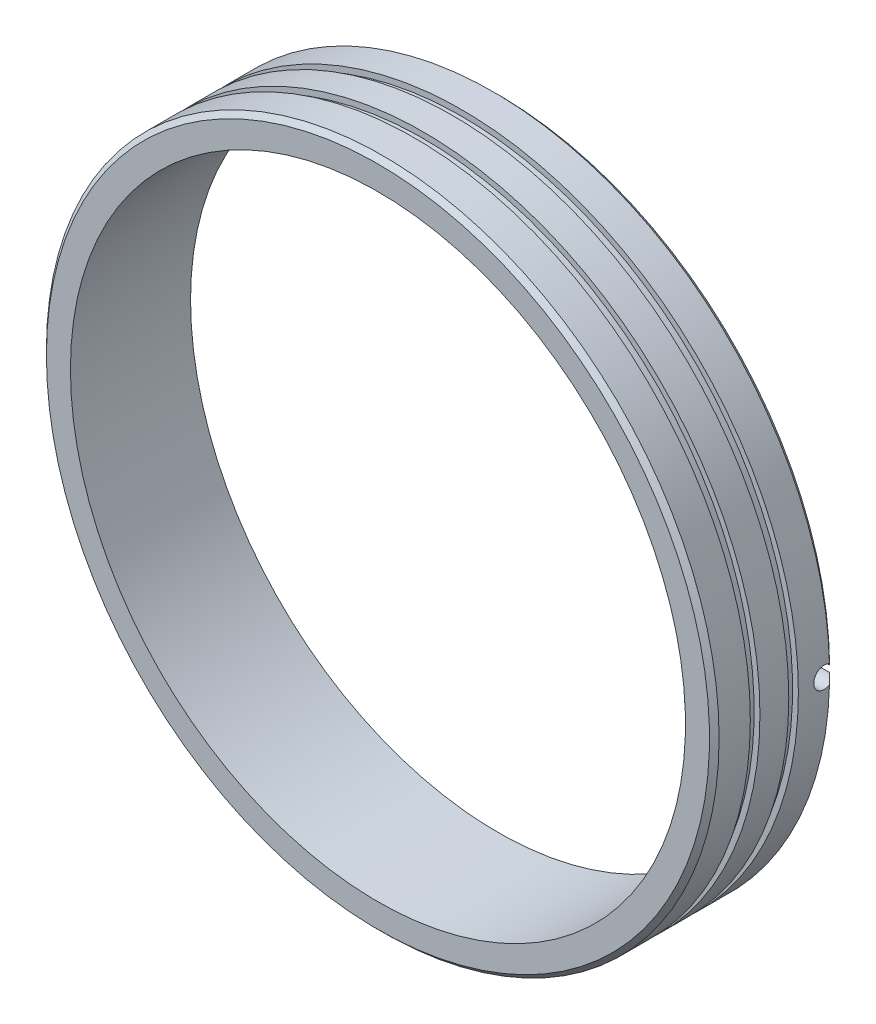
from build123d import *

# Parameters (mm, degrees)
SKETCH2_R           = 2.2
GRUB_KEY_HOLE_DEPTH = 8


with BuildPart() as part:
    # Sketch1 → Tyre (revolve)
    with BuildSketch(Plane(origin=(0, 0, 0), x_dir=(0, 0, -1), z_dir=(1, 0, 0)), mode=Mode.PRIVATE) as tyre_sk:
        Polygon((-1.5, 64), (-26.5, 64), (-26.5, 69), (-25.5, 70), (-19, 70), (-19, 68.8), (-17, 68.8), (-17, 70), (-11, 70), (-11, 68.8), (-9, 68.8), (-9, 70), (-2.5, 70), (-1.5, 69), align=None)
    revolve(tyre_sk.sketch.rotate(Axis((0, 0, 0), (0, 0, 1)), 90), axis=Axis((0, 0, 0), (0, 0, 1)))

    # Sketch2 → Grub_key_hole (cut)
    with BuildSketch(Plane(origin=(63, 0, 0), x_dir=(0, 0, -1), z_dir=(1, 0, 0))):
        with Locations((-3.6, 0)):
            Circle(SKETCH2_R)
    extrude(amount=GRUB_KEY_HOLE_DEPTH, mode=Mode.SUBTRACT)


solid = part.part
